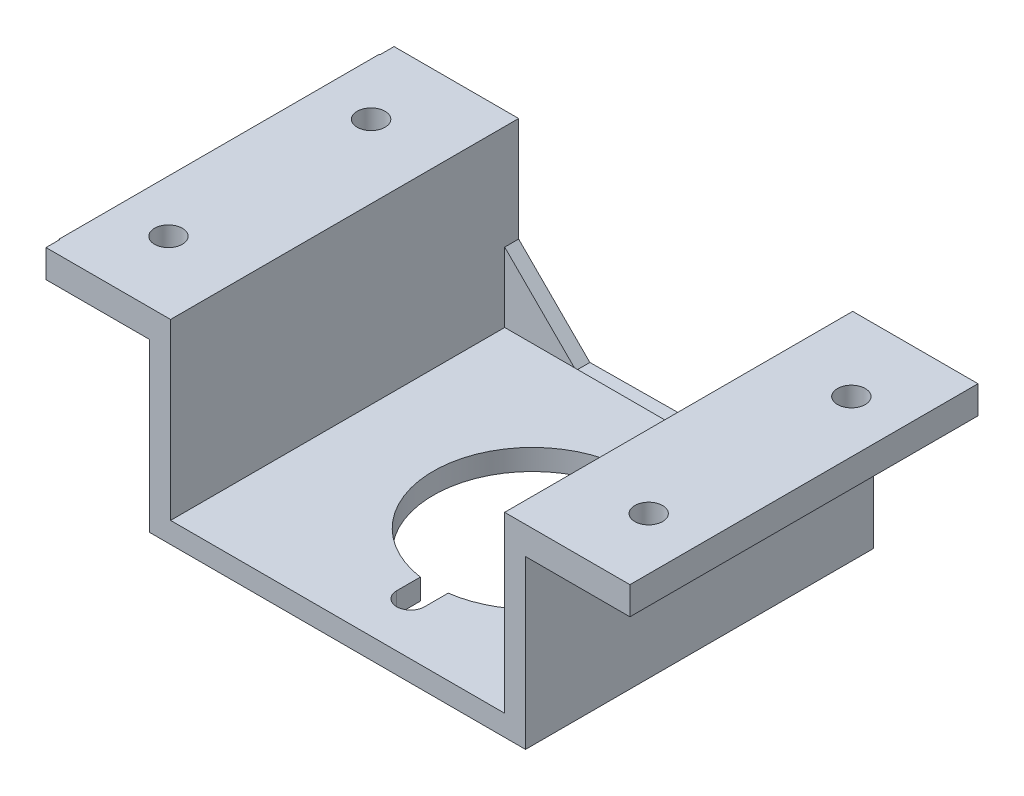
from build123d import *

# Parameters (mm, degrees)
SKETCH1_W            = 50
SKETCH1_H            = 40
BOSS_EXTRUDE1_DEPTH  = 3
SKETCH6_R            = 2
CUT_EXTRUDE9_DEPTH   = 5
SKETCH16_W           = 14.8
SKETCH16_H           = 3
CUT_EXTRUDE10_DEPTH  = 0.5
SKETCH21_R           = 14.25
CUT_EXTRUDE15_DEPTH  = 4
CUT_EXTRUDE16_START  = -4
CUT_EXTRUDE16_DEPTH  = 4
SKETCH33_W           = 4
SKETCH33_H           = 35
CUT_EXTRUDE23_DEPTH  = 5
SKETCH34_W           = 49.986920535
SKETCH34_H           = 3
BOSS_EXTRUDE2_DEPTH  = 3
SKETCH35_W           = 50
SKETCH35_H           = 3
BOSS_EXTRUDE3_DEPTH  = 3
SKETCH36_W           = 46
SKETCH36_H           = 3
BOSS_EXTRUDE4_DEPTH  = 4
SKETCH38_W           = 3
SKETCH38_H           = 46
BOSS_EXTRUDE5_DEPTH  = 25
SKETCH39_W           = 45.535565308
SKETCH39_H           = 3
BOSS_EXTRUDE6_DEPTH  = 15
SKETCH40_W           = 46
SKETCH40_H           = 3
BOSS_EXTRUDE7_DEPTH  = 15
SKETCH41_W           = 0.464434692
SKETCH41_H           = 3
BOSS_EXTRUDE8_DEPTH  = 15
SKETCH42_R           = 2
CUT_EXTRUDE24_DEPTH  = 15
SKETCH43_R           = 2
CUT_EXTRUDE25_DEPTH  = 15
BOSS_EXTRUDE10_START = 1
SKETCH44_W           = 14.986920535
SKETCH44_H           = 46
SKETCH44_R           = 2
BOSS_EXTRUDE10_DEPTH = 1
BOSS_EXTRUDE11_START = 1
SKETCH46_W           = 15
SKETCH46_H           = 46
SKETCH46_R           = 2
BOSS_EXTRUDE11_DEPTH = 1
BOSS_EXTRUDE12_DEPTH = 2
BOSS_EXTRUDE13_DEPTH = 2
SKETCH49_W           = 47.986920535
SKETCH49_H           = 2
BOSS_EXTRUDE14_DEPTH = 10
CUT_EXTRUDE26_DEPTH  = 10


with BuildPart() as part:
    # Sketch1 → Boss-Extrude1 (new body)
    with BuildSketch(Plane(origin=(0, 0, 0), x_dir=(1, 0, 0), z_dir=(0, 1, 0))):
        with Locations((1.920937393, -5.615172506)):
            Rectangle(SKETCH1_W, SKETCH1_H)
    extrude(amount=BOSS_EXTRUDE1_DEPTH)

    # Sketch6 → Cut-Extrude9 (cut)
    with BuildSketch(Plane.XZ):
        with Locations(Location((6.920937393, 23.115172506, 0), (0, 0, 270))):
            Circle(SKETCH6_R)
        with Locations(Location((6.920937393, -11.884827494, 0), (0, 0, 270))):
            Circle(SKETCH6_R)
        with BuildLine():
            Line((24.420937393, 13.015172506), (18.923020545, 13.015172506))
            ThreePointArc((18.923020545, 13.015172506), (-7.179062607, 5.615172506), (18.923020545, -1.784827494))
            Line((18.923020545, -1.784827494), (24.420937393, -1.784827494))
            Line((24.420937393, -1.784827494), (24.420937393, 5.615172506))
            Line((24.420937393, 5.615172506), (24.420937393, 13.015172506))
        make_face()
    extrude(amount=-CUT_EXTRUDE9_DEPTH, mode=Mode.SUBTRACT)

    # Sketch16 → Cut-Extrude10 (cut)
    with BuildSketch(Plane.ZY.offset(-24.420937393)):
        with Locations((5.615172506, 1.5)):
            Rectangle(SKETCH16_W, SKETCH16_H)
    extrude(amount=-CUT_EXTRUDE10_DEPTH, mode=Mode.SUBTRACT)

    # Sketch21 → Cut-Extrude15 (cut)
    with BuildSketch(Plane(origin=(0, 0, 0), x_dir=(-1, 0, 0), z_dir=(0, -1, 0))):
        with Locations((-6.920937393, -5.615172506)):
            Circle(SKETCH21_R)
    extrude(amount=-CUT_EXTRUDE15_DEPTH, mode=Mode.SUBTRACT)

    # Sketch22 → Cut-Extrude16 (cut)
    with BuildSketch(Plane(origin=(0, 3, 0), x_dir=(1, 0, 0), z_dir=(0, 1, 0)).offset(CUT_EXTRUDE16_START)):
        with BuildLine():
            ThreePointArc((21.106680727, 1.784827494), (20.39103932, 3.019158274), (19.568281538, 4.184827494))
            Line((19.568281538, 4.184827494), (17.266105347, 4.184827494))
            ThreePointArc((17.266105347, 4.184827494), (18.246250908, 3.03351374), (19.09888878, 1.784827494))
            Line((19.09888878, 1.784827494), (21.106680727, 1.784827494))
        make_face()
        with BuildLine():
            Line((17.266105347, -15.415172506), (19.568281538, -15.415172506))
            ThreePointArc((19.568281538, -15.415172506), (20.39103932, -14.249503286), (21.106680727, -13.015172506))
            Line((21.106680727, -13.015172506), (19.09888878, -13.015172506))
            ThreePointArc((19.09888878, -13.015172506), (18.246250908, -14.263858752), (17.266105347, -15.415172506))
        make_face()
    extrude(amount=CUT_EXTRUDE16_DEPTH, mode=Mode.SUBTRACT)

    # Sketch33 → Cut-Extrude23 (cut)
    with BuildSketch(Plane(origin=(0, 3, 0), x_dir=(1, 0, 0), z_dir=(0, 1, 0))):
        with Locations((6.920937393, -5.615172506)):
            Rectangle(SKETCH33_W, SKETCH33_H)
    extrude(amount=-CUT_EXTRUDE23_DEPTH, mode=Mode.SUBTRACT)

    # Sketch34 → Boss-Extrude2 (add)
    with BuildSketch(Plane(origin=(0, 0, -14.384827494), x_dir=(-1, 0, 0), z_dir=(0, 0, -1))):
        with Locations((-1.927477126, 1.5)):
            Rectangle(SKETCH34_W, SKETCH34_H)
    extrude(amount=BOSS_EXTRUDE2_DEPTH)

    # Sketch35 → Boss-Extrude3 (add)
    with BuildSketch(Plane.XY.offset(25.615172506)):
        with Locations((1.920937393, 1.5)):
            Rectangle(SKETCH35_W, SKETCH35_H)
    extrude(amount=BOSS_EXTRUDE3_DEPTH)

    # Sketch36 → Boss-Extrude4 (add)
    with BuildSketch(Plane(origin=(26.920937393, 0, 0), x_dir=(0, 0, -1), z_dir=(1, 0, 0))):
        with Locations((-5.615172506, 1.5)):
            Rectangle(SKETCH36_W, SKETCH36_H)
    extrude(amount=BOSS_EXTRUDE4_DEPTH)

    # Sketch38 → Boss-Extrude5 (add)
    with BuildSketch(Plane(origin=(0, 3, 0), x_dir=(1, 0, 0), z_dir=(0, 1, 0))):
        with Locations((29.420937393, -5.615172506)):
            Rectangle(SKETCH38_W, SKETCH38_H)
        with Locations((-21.565983142, -5.615172506)):
            Rectangle(SKETCH38_W, SKETCH38_H)
    extrude(amount=BOSS_EXTRUDE5_DEPTH)

    # Sketch39 → Boss-Extrude6 (add)
    with BuildSketch(Plane.ZY.offset(23.065983142)):
        with Locations((5.38295516, 26.5)):
            Rectangle(SKETCH39_W, SKETCH39_H)
    extrude(amount=BOSS_EXTRUDE6_DEPTH)

    # Sketch40 → Boss-Extrude7 (add)
    with BuildSketch(Plane(origin=(30.920937393, 0, 0), x_dir=(0, 0, -1), z_dir=(1, 0, 0))):
        with Locations((-5.615172506, 26.5)):
            Rectangle(SKETCH40_W, SKETCH40_H)
    extrude(amount=BOSS_EXTRUDE7_DEPTH)

    # Sketch41 → Boss-Extrude8 (add)
    with BuildSketch(Plane.ZY.offset(23.065983142)):
        with Locations((28.38295516, 26.5)):
            Rectangle(SKETCH41_W, SKETCH41_H)
    extrude(amount=BOSS_EXTRUDE8_DEPTH)

    # Sketch42 → Cut-Extrude24 (cut)
    with BuildSketch(Plane.XZ.offset(-25)):
        with Locations(Location((38.420937393, 20.419520332, 0), (0, 0, 270))):
            Circle(SKETCH42_R)
        with Locations(Location((38.420937393, -8.692413747, 0), (0, 0, 270))):
            Circle(SKETCH42_R)
    extrude(amount=-CUT_EXTRUDE24_DEPTH, mode=Mode.SUBTRACT)

    # Sketch43 → Cut-Extrude25 (cut)
    with BuildSketch(Plane.XZ.offset(-25)):
        with Locations(Location((-30.565983142, 20.419520332, 0), (0, 0, 270))):
            Circle(SKETCH43_R)
        with Locations(Location((-30.565983142, -8.692413747, 0), (0, 0, 270))):
            Circle(SKETCH43_R)
    extrude(amount=-CUT_EXTRUDE25_DEPTH, mode=Mode.SUBTRACT)

    # Sketch44 → Boss-Extrude10 (add)
    with BuildSketch(Plane.XZ.offset(-25).offset(BOSS_EXTRUDE10_START)):
        with Locations((-30.572522875, 5.615172506)):
            Rectangle(SKETCH44_W, SKETCH44_H)
        with Locations(Location((-30.565983142, -8.692413747, 0), (0, 0, 270))):
            Circle(SKETCH44_R, mode=Mode.SUBTRACT)
        with Locations(Location((-30.565983142, 20.419520332, 0), (0, 0, 270))):
            Circle(SKETCH44_R, mode=Mode.SUBTRACT)
    extrude(amount=-BOSS_EXTRUDE10_DEPTH)

    # Sketch46 → Boss-Extrude11 (add)
    with BuildSketch(Plane.XZ.offset(-25).offset(BOSS_EXTRUDE11_START)):
        with Locations((38.420937393, 5.615172506)):
            Rectangle(SKETCH46_W, SKETCH46_H)
        with Locations(Location((38.420937393, -8.692413747, 0), (0, 0, 270))):
            Circle(SKETCH46_R, mode=Mode.SUBTRACT)
        with Locations(Location((38.420937393, 20.419520332, 0), (0, 0, 270))):
            Circle(SKETCH46_R, mode=Mode.SUBTRACT)
    extrude(amount=-BOSS_EXTRUDE11_DEPTH)

    # Sketch47 → Boss-Extrude12 (add)
    with BuildSketch(Plane(origin=(0, 0, -17.384827494), x_dir=(-1, 0, 0), z_dir=(0, 0, -1))):
        Polygon((-27.920937393, 28), (-45.920937393, 28), (-45.920937393, 24), (-30.920937393, 24), (-30.920937393, 0), (23.065983142, 0), (23.065983142, 3), (23.065983142, 25), (23.079062607, 25), (23.079062607, 24), (37.960253495, 24), (37.960253495, 28), (20.065983142, 28), (20.065983142, 3), (-27.920937393, 3), align=None)
    extrude(amount=BOSS_EXTRUDE12_DEPTH)

    # Sketch48 → Boss-Extrude13 (add)
    with BuildSketch(Plane.XY.offset(28.615172506)):
        Polygon((-20.065983142, 28), (-37.960253495, 28), (-37.960253495, 24), (-23.079062607, 24), (-23.079062607, 25), (-23.065983142, 25), (-23.065983142, 3), (-23.065983142, 0), (30.920937393, 0), (30.920937393, 24), (45.920937393, 24), (45.920937393, 28), (27.920937393, 28), (27.920937393, 3), (-20.065983142, 3), align=None)
    extrude(amount=BOSS_EXTRUDE13_DEPTH)

    # Sketch49 → Boss-Extrude14 (add)
    with BuildSketch(Plane(origin=(0, 3, 0), x_dir=(1, 0, 0), z_dir=(0, 1, 0))):
        with Locations((3.927477126, 18.384827494)):
            Rectangle(SKETCH49_W, SKETCH49_H)
    extrude(amount=BOSS_EXTRUDE14_DEPTH)

    # Sketch50 → Cut-Extrude26 (cut)
    with BuildSketch(Plane.XY.offset(-17.384827494)):
        Polygon((-20.065983142, 13), (-9.830586805, 2.764603663), (17.920937393, 3), (27.920937393, 13), align=None)
    extrude(amount=-CUT_EXTRUDE26_DEPTH, mode=Mode.SUBTRACT)


solid = part.part
